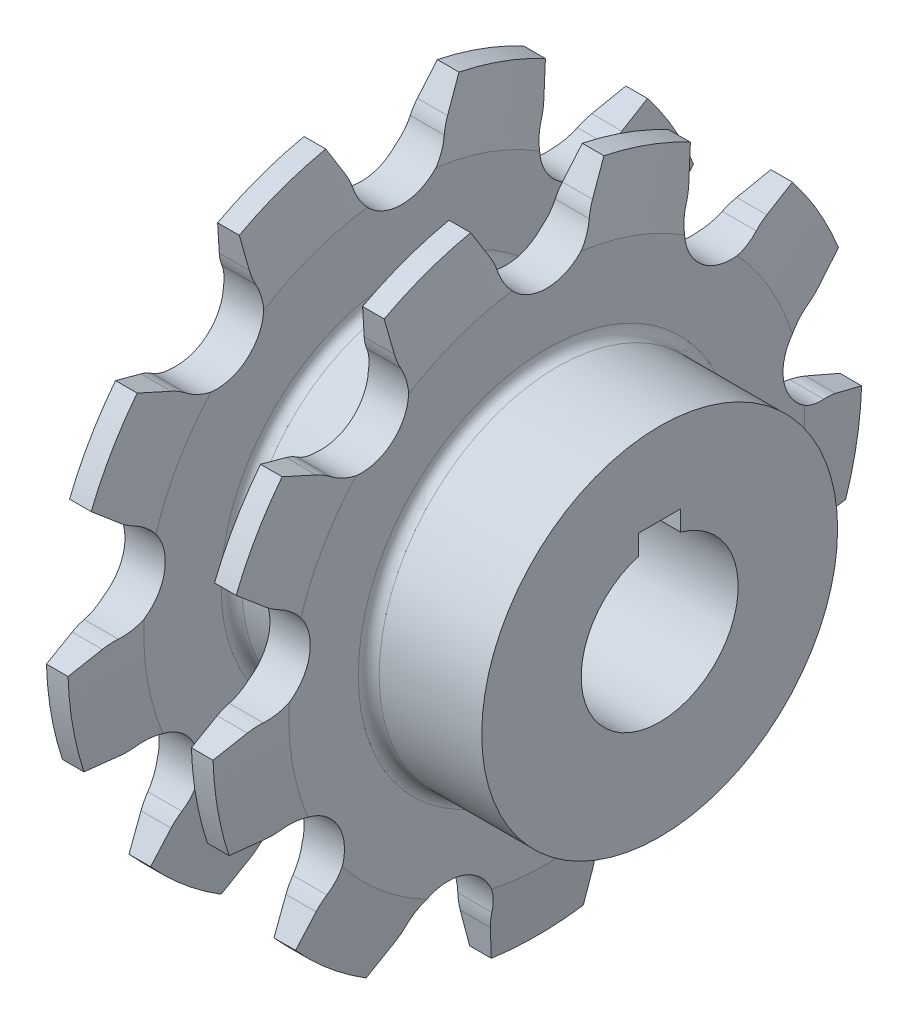
from build123d import *

# Parameters (mm, degrees)
CUT_EXTRUDE_1_DEPTH       = 105.580112832
CUT_EXTRUDE_2_DEPTH       = 105.580112832
PATTERN_CIRCULAR_10_COUNT = 9


with BuildPart() as part:
    # 草圖1 → 旋轉3 (revolve)
    with BuildSketch(Plane.XY, mode=Mode.PRIVATE) as revolve_3_sk:
        with BuildLine():
            Line((0, 0), (0, 49.3))
            Line((0, 49.3), (1.784868601, 62))
            Line((1.784868601, 62), (5.915131399, 62))
            Line((5.915131399, 62), (7.7, 49.3))
            Line((7.7, 49.3), (7.7, 34.5))
            ThreePointArc((7.7, 34.5), (8.285786438, 33.085786438), (9.7, 32.5))
            Line((9.7, 32.5), (25.7, 32.5))
            ThreePointArc((25.7, 32.5), (27.114213562, 33.085786438), (27.7, 34.5))
            Line((27.7, 34.5), (27.7, 49.3))
            Line((27.7, 49.3), (29.484868601, 62))
            Line((29.484868601, 62), (33.615131399, 62))
            Line((33.615131399, 62), (35.4, 49.3))
            Line((35.4, 49.3), (35.4, 36))
            ThreePointArc((35.4, 36), (35.985786438, 34.585786438), (37.4, 34))
            Line((37.4, 34), (57, 34))
            Line((57, 34), (57, 0))
            Line((57, 0), (0, 0))
        make_face()
    revolve(revolve_3_sk.sketch.rotate(Axis((0, 0, 0), (1, 0, 0)), 90), axis=Axis((0, 0, 0), (1, 0, 0)))

    # 草圖2 → 除料-伸長1 (cut, through all)
    with BuildSketch(Plane(origin=(57, 0, 0), x_dir=(0, 0, -1), z_dir=(1, 0, 0))):
        with BuildLine():
            Line((-4, 18.3), (4, 18.3))
            Line((4, 18.3), (4, 14.456832295))
            ThreePointArc((4, 14.456832295), (0, -15), (-4, 14.456832295))
            Line((-4, 14.456832295), (-4, 18.3))
        make_face()
    extrude(amount=-CUT_EXTRUDE_1_DEPTH, mode=Mode.SUBTRACT)

    # 草圖3 → 除料-伸長2 (cut, through all)
    with BuildSketch(Plane.ZY):
        with BuildLine():
            Line((-12.73103426, 60.678832938), (-9.739460014, 55.373547605))
            ThreePointArc((-9.739460014, 55.373547605), (-9.153475931, 54.146012943), (-8.739498857, 52.850311714))
            ThreePointArc((-8.739498857, 52.850311714), (0, 46), (8.739498857, 52.850311714))
            ThreePointArc((8.739498857, 52.850311714), (9.153475931, 54.146012943), (9.739460014, 55.373547605))
            Line((9.739460014, 55.373547605), (12.73103426, 60.678832938))
            ThreePointArc((12.73103426, 60.678832938), (0, 62), (-12.73103426, 60.678832938))
        make_face()
    cut_extrude_2 = extrude(amount=-CUT_EXTRUDE_2_DEPTH, mode=Mode.SUBTRACT)

    # 環狀複製排列10: 除料-伸長2 ×9 about axis
    pattern_circular_10_axis = Axis((0, 0, 0), (1, 0, 0))
    for i in range(1, PATTERN_CIRCULAR_10_COUNT):
        add(cut_extrude_2.rotate(pattern_circular_10_axis, i * 360 / PATTERN_CIRCULAR_10_COUNT), mode=Mode.SUBTRACT)


solid = part.part
